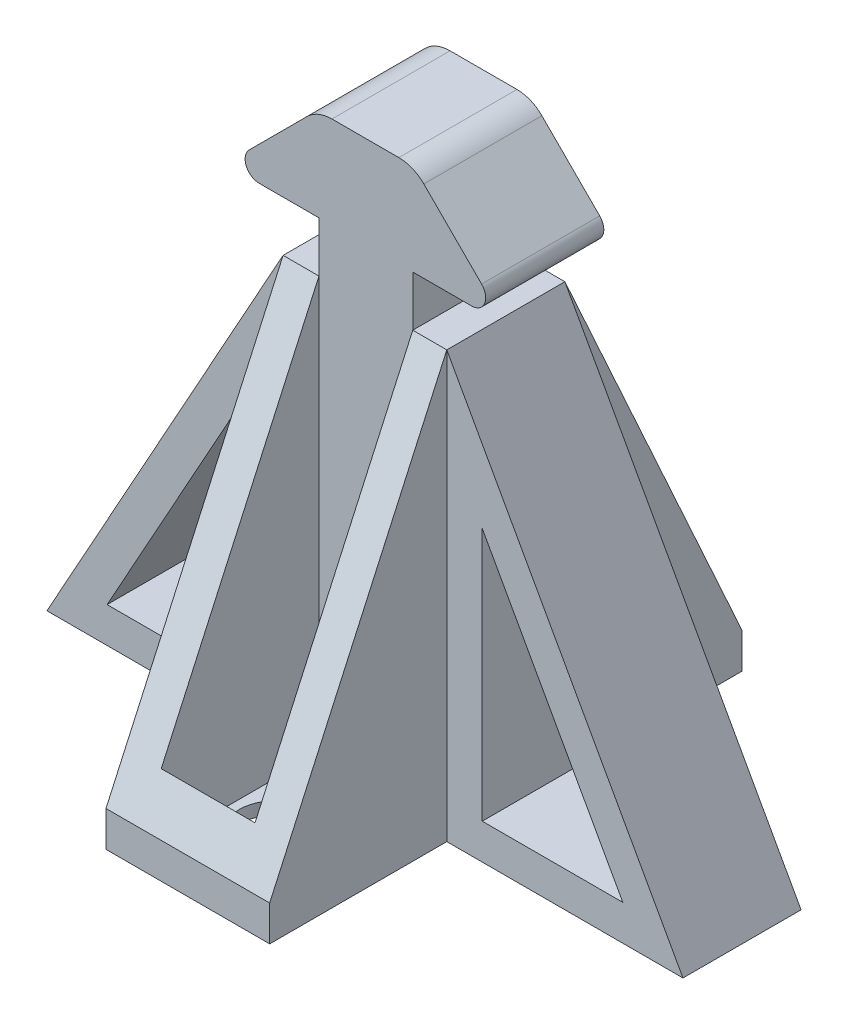
from build123d import *

# Parameters (mm, degrees)
BOSS_EXTRUDE1_DEPTH      = 10
BOSS_EXTRUDE2_DEPTH      = 15
BOSS_EXTRUDE2_DEPTH_BACK = 25
SKETCH2_W                = 13.86324318
SKETCH2_H                = 2.640648634
SKETCH3_R                = 3.15
CUT_EXTRUDE1_DEPTH       = 2.65
BOSS_EXTRUDE3_DEPTH      = 10
SKETCH5_R                = 3.15
CUT_EXTRUDE2_DEPTH       = 10
BOSS_EXTRUDE4_DEPTH      = 15
BOSS_EXTRUDE4_DEPTH_BACK = 25
SKETCH7_W                = 13.86324318
SKETCH7_H                = 33.4262151
CUT_EXTRUDE3_DEPTH       = 15
SKETCH13_W               = 7.942289342
SKETCH13_H               = 13.358433402
SKETCH13_H_2             = 13.079806518
CUT_EXTRUDE4_DEPTH       = 35


with BuildPart() as part:
    # Sketch1 → Boss-Extrude1 (new body)
    with BuildSketch(Plane.XY):
        with BuildLine():
            Line((-102.490463188, 678.270987862), (-97.502783366, 678.270987862))
            ThreePointArc((-97.502783366, 678.270987862), (-96.402724844, 679.006023468), (-96.660835024, 680.30363097))
            Line((-96.660835024, 680.30363097), (-101.554583476, 685.197379422))
            ThreePointArc((-101.554583476, 685.197379422), (-102.523344038, 685.844684534), (-103.666075035, 686.071987862))
            Line((-103.666075035, 686.071987862), (-109.332102168, 686.071987862))
            ThreePointArc((-109.332102168, 686.071987862), (-110.474833165, 685.844684534), (-111.443593727, 685.197379422))
            Line((-111.443593727, 685.197379422), (-116.337342179, 680.30363097))
            ThreePointArc((-116.337342179, 680.30363097), (-116.595452359, 679.006023468), (-115.495393837, 678.270987862))
            Line((-115.495393837, 678.270987862), (-112.290288601, 678.270987862))
            Line((-112.290288601, 678.270987862), (-110.43275253, 678.270987862))
            Line((-110.43275253, 678.270987862), (-110.43275253, 674.001864678))
            Line((-110.43275253, 674.001864678), (-113.469742626, 674.001864678))
            Line((-113.469742626, 674.001864678), (-113.469742626, 640.576503739))
            Line((-113.469742626, 640.576503739), (-113.469742626, 637.935000944))
            Line((-113.469742626, 637.935000944), (-99.606499446, 637.935000944))
            Line((-99.606499446, 637.935000944), (-99.606499446, 674.001864678))
            Line((-99.606499446, 674.001864678), (-102.490463188, 674.001864678))
            Line((-102.490463188, 674.001864678), (-102.490463188, 678.270987862))
        make_face()
    extrude(amount=-BOSS_EXTRUDE1_DEPTH)

    # Sketch2 → Boss-Extrude2 (add, two sides: drawn at the far end of the back side and taken through both)
    with BuildSketch(Plane.XY.offset(-BOSS_EXTRUDE2_DEPTH_BACK)):
        with Locations((-106.538121036, 639.255325261)):
            Rectangle(SKETCH2_W, SKETCH2_H)
    extrude(amount=BOSS_EXTRUDE2_DEPTH + BOSS_EXTRUDE2_DEPTH_BACK)

    # Sketch3 → Cut-Extrude1 (cut)
    with BuildSketch(Plane(origin=(0, 640.575649578, 0), x_dir=(1, 0, 0), z_dir=(0, 1, 0))):
        with Locations(Location((-106.538121036, -7.5, 0), (0, 0, 270))):
            Circle(SKETCH3_R)
    extrude(amount=-CUT_EXTRUDE1_DEPTH, mode=Mode.SUBTRACT)

    # Sketch4 → Boss-Extrude3 (add)
    # profile 1 of 2: a face of its own
    with BuildSketch(Plane(origin=(0, 0, -10), x_dir=(-1, 0, 0), z_dir=(0, 0, -1))):
        Polygon((99.606499446, 637.935000944), (79.606499446, 637.935000944), (99.606499446, 674.001864678), align=None)
        Polygon((84.700453543, 640.935000944), (96.606499446, 662.405687703), (96.606499446, 640.935000944), align=None, mode=Mode.SUBTRACT)
    # profile 2 of 2: a face of its own
    with BuildSketch(Plane(origin=(0, 0, -10), x_dir=(-1, 0, 0), z_dir=(0, 0, -1))):
        Polygon((113.469742626, 637.935000944), (133.469742626, 637.935000944), (113.469742626, 674.001864678), align=None)
        Polygon((116.469742626, 662.405687703), (116.469742626, 640.935000944), (128.375788529, 640.935000944), align=None, mode=Mode.SUBTRACT)
    extrude(amount=-BOSS_EXTRUDE3_DEPTH)

    # Sketch5 → Cut-Extrude2 (cut)
    with BuildSketch(Plane(origin=(0, 640.575649578, 0), x_dir=(1, 0, 0), z_dir=(0, 1, 0))):
        with Locations(Location((-106.538121036, 17.5, 0), (0, 0, 270))):
            Circle(SKETCH5_R)
    extrude(amount=-CUT_EXTRUDE2_DEPTH, mode=Mode.SUBTRACT)

    # Sketch7 → Boss-Extrude4 (add, two sides: drawn at the far end of the back side and taken through both)
    with BuildSketch(Plane(origin=(0, 0, -10), x_dir=(-1, 0, 0), z_dir=(0, 0, -1)).offset(-BOSS_EXTRUDE4_DEPTH_BACK)):
        with Locations((106.538121036, 657.288757128)):
            Rectangle(SKETCH7_W, SKETCH7_H)
    extrude(amount=BOSS_EXTRUDE4_DEPTH + BOSS_EXTRUDE4_DEPTH_BACK)

    # Sketch10 → Cut-Extrude3 (cut)
    with BuildSketch(Plane(origin=(-99.606499446, 0, 0), x_dir=(0, 0, -1), z_dir=(1, 0, 0))):
        Polygon((25, 674.001864678), (10, 674.001864678), (25, 640.935000944), align=None)
        Polygon((-15, 640.935000944), (0, 674.001864678), (-15, 674.001864678), align=None)
    extrude(amount=-CUT_EXTRUDE3_DEPTH, mode=Mode.SUBTRACT)

    # Sketch13 → Cut-Extrude4 (cut)
    with BuildSketch(Plane(origin=(0, 674.001864678, 0), x_dir=(1, 0, 0), z_dir=(0, 1, 0))):
        with Locations((-106.461607859, -6.679216701)):
            Rectangle(SKETCH13_W, SKETCH13_H)
        with Locations((-106.461607859, 16.539903259)):
            Rectangle(SKETCH13_W, SKETCH13_H_2)
    extrude(amount=-CUT_EXTRUDE4_DEPTH, mode=Mode.SUBTRACT)


solid = part.part
